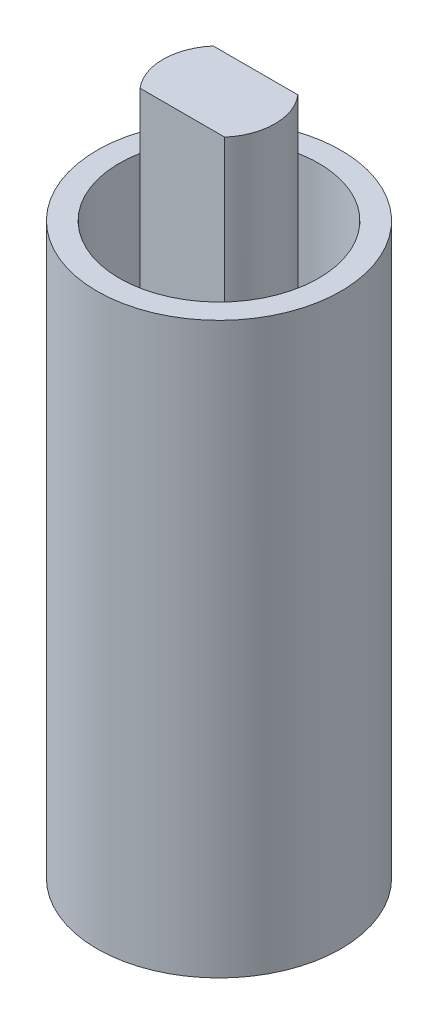
from build123d import *
from build123d.topology import SkipClean

# Parameters (mm, degrees)
SKETCH1_R           = 2.75
BOSS_EXTRUDE1_DEPTH = 1.8
BOSS_EXTRUDE2_DEPTH = 21.7
SKETCH4_R           = 6
BOSS_EXTRUDE3_DEPTH = 10
BOSS_EXTRUDE4_START = 18
SKETCH5_R           = 6
SKETCH5_R_2         = 4.9
BOSS_EXTRUDE4_DEPTH = 18


with BuildPart() as part:
    # Sketch1 → Boss-Extrude1 (new body)
    with BuildSketch(Plane(origin=(0, 0, 0), x_dir=(1, 0, 0), z_dir=(0, 1, 0))):
        with Locations(Location((0, 0, 0), (0, 0, 270))):
            Circle(SKETCH1_R)
    extrude(amount=BOSS_EXTRUDE1_DEPTH)

    # Sketch3 → Boss-Extrude2 (add)
    with SkipClean():  # the faces are left unmerged after this step: merging them gives an invalid solid
        with BuildSketch(Plane(origin=(0, 1.8, 0), x_dir=(1, 0, 0), z_dir=(0, 1, 0))):
            with BuildLine():
                Line((-2.0790623, 1.799999987), (2.0790623, 1.799999987))
                ThreePointArc((2.0790623, 1.799999987), (2.75, 0), (2.0790623, -1.799999987))
                Line((2.0790623, -1.799999987), (-2.0790623, -1.799999987))
                ThreePointArc((-2.0790623, -1.799999987), (-2.75, 0), (-2.0790623, 1.799999987))
            make_face()
        extrude(amount=BOSS_EXTRUDE2_DEPTH)

    # Sketch4 → Boss-Extrude3 (add)
    with SkipClean():  # the faces are left unmerged after this step: merging them gives an invalid solid
        with BuildSketch(Plane.XZ):
            with Locations(Location((0, 0, 0), (0, 0, 270))):
                Circle(SKETCH4_R)
        extrude(amount=BOSS_EXTRUDE3_DEPTH)

    # Sketch5 → Boss-Extrude4 (add)
    with BuildSketch(Plane(origin=(0, 0, 0), x_dir=(1, 0, 0), z_dir=(0, 1, 0)).offset(BOSS_EXTRUDE4_START)):
        with Locations(Location((0, 0, 0), (0, 0, 270))):
            Circle(SKETCH5_R)
        with Locations(Location((0, 0, 0), (0, 0, 270))):
            Circle(SKETCH5_R_2, mode=Mode.SUBTRACT)
    extrude(amount=-BOSS_EXTRUDE4_DEPTH)


solid = part.part
